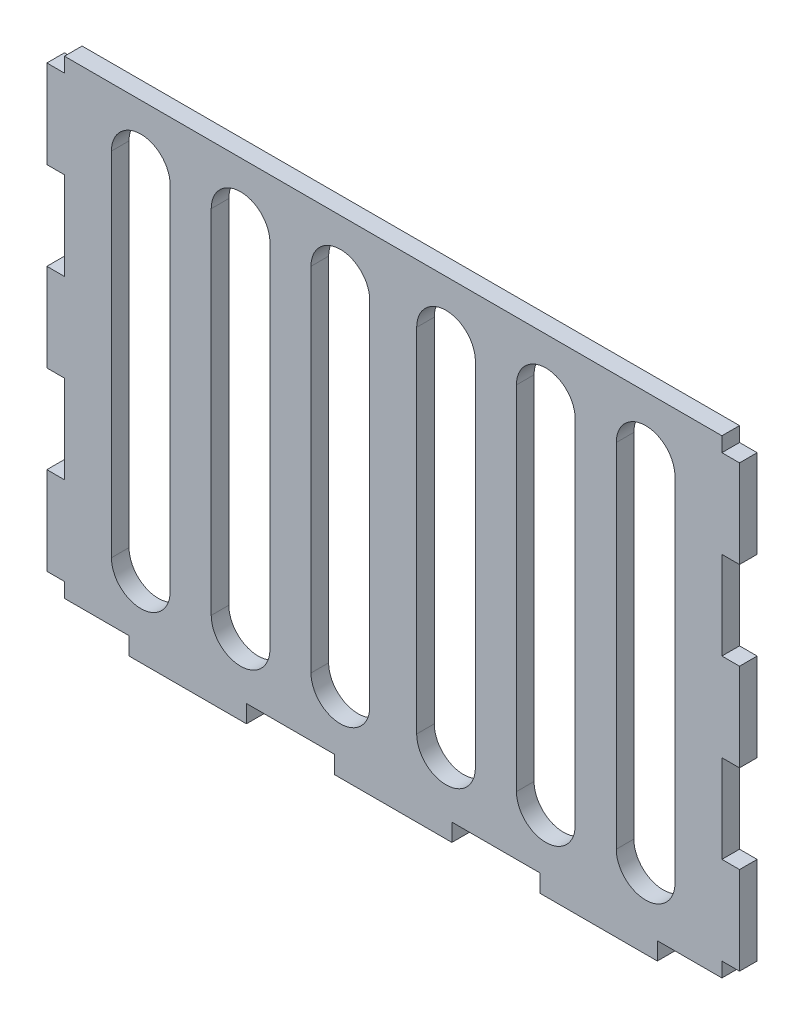
from build123d import *

# Parameters (mm, degrees)
SKETCH1_W           = 3
SKETCH1_H           = 15
SKETCH1_W_2         = 112
SKETCH1_H_2         = 80
SKETCH1_W_3         = 20
SKETCH1_H_3         = 3
BOSS_EXTRUDE1_DEPTH = 3


with BuildPart() as part:
    # Sketch1 → Boss-Extrude1 (new body)
    # profile 1 of 10: a face of its own
    with BuildSketch(Plane.XY):
        with Locations((-57.5, 30)):
            Rectangle(SKETCH1_W, SKETCH1_H)
    # profile 2 of 10: a face of its own
    with BuildSketch(Plane.XY):
        Rectangle(SKETCH1_W_2, SKETCH1_H_2)
        with BuildLine():
            ThreePointArc((-4, 30), (-9, 35), (-14, 30))
            Line((-14, 30), (-14, -30))
            ThreePointArc((-14, -30), (-9, -35), (-4, -30))
            Line((-4, -30), (-4, 30))
        make_face(mode=Mode.SUBTRACT)
        with BuildLine():
            ThreePointArc((-21, 30), (-26, 35), (-31, 30))
            Line((-31, 30), (-31, -30))
            ThreePointArc((-31, -30), (-26, -35), (-21, -30))
            Line((-21, -30), (-21, 30))
        make_face(mode=Mode.SUBTRACT)
        with BuildLine():
            ThreePointArc((-38, 30), (-43, 35), (-48, 30))
            Line((-48, 30), (-48, -30))
            ThreePointArc((-48, -30), (-43, -35), (-38, -30))
            Line((-38, -30), (-38, 30))
        make_face(mode=Mode.SUBTRACT)
        with BuildLine():
            Line((4, -30), (4, 30))
            ThreePointArc((4, 30), (9, 35), (14, 30))
            Line((14, 30), (14, -30))
            ThreePointArc((14, -30), (9, -35), (4, -30))
        make_face(mode=Mode.SUBTRACT)
        with BuildLine():
            Line((21, -30), (21, 30))
            ThreePointArc((21, 30), (26, 35), (31, 30))
            Line((31, 30), (31, -30))
            ThreePointArc((31, -30), (26, -35), (21, -30))
        make_face(mode=Mode.SUBTRACT)
        with BuildLine():
            Line((38, -30), (38, 30))
            ThreePointArc((38, 30), (43, 35), (48, 30))
            Line((48, 30), (48, -30))
            ThreePointArc((48, -30), (43, -35), (38, -30))
        make_face(mode=Mode.SUBTRACT)
    # profile 3 of 10: a face of its own
    with BuildSketch(Plane.XY):
        with Locations((-57.5, 0)):
            Rectangle(SKETCH1_W, SKETCH1_H)
    # profile 4 of 10: a face of its own
    with BuildSketch(Plane.XY):
        with Locations((-35, -41.5)):
            Rectangle(SKETCH1_W_3, SKETCH1_H_3)
    # profile 5 of 10: a face of its own
    with BuildSketch(Plane.XY):
        with Locations((0, -41.5)):
            Rectangle(SKETCH1_W_3, SKETCH1_H_3)
    # profile 6 of 10: a face of its own
    with BuildSketch(Plane.XY):
        with Locations((35, -41.5)):
            Rectangle(SKETCH1_W_3, SKETCH1_H_3)
    # profile 7 of 10: a face of its own
    with BuildSketch(Plane.XY):
        with Locations((57.5, 0)):
            Rectangle(SKETCH1_W, SKETCH1_H)
    # profile 8 of 10: a face of its own
    with BuildSketch(Plane.XY):
        with Locations((57.5, 30)):
            Rectangle(SKETCH1_W, SKETCH1_H)
    # profile 9 of 10: a face of its own
    with BuildSketch(Plane.XY):
        with Locations((-57.5, -30)):
            Rectangle(SKETCH1_W, SKETCH1_H)
    # profile 10 of 10: a face of its own
    with BuildSketch(Plane.XY):
        with Locations((57.5, -30)):
            Rectangle(SKETCH1_W, SKETCH1_H)
    extrude(amount=BOSS_EXTRUDE1_DEPTH)


solid = part.part
